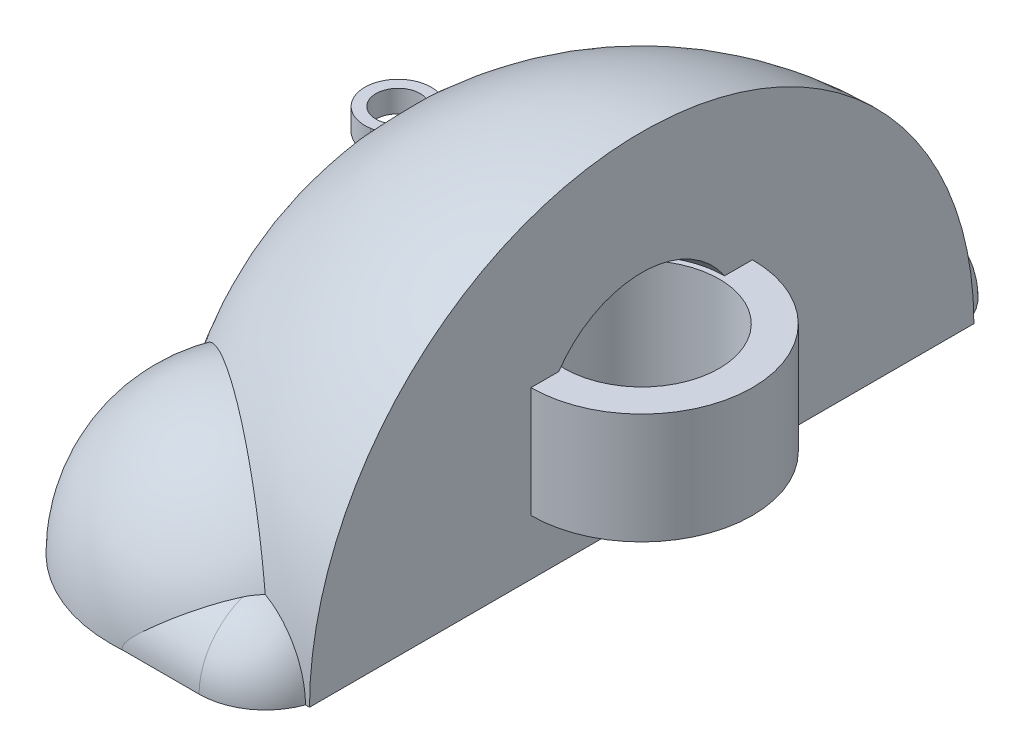
from build123d import *

# Parameters (mm, degrees)
REVOLUCI_N1_ANGLE            = 90
REVOLUCI_N16_ANGLE           = 180
REVOLUCI_N20_ANGLE           = 180
REVOLUCI_N23_ANGLE           = 180
REVOLUCI_N24_ANGLE           = 180
SALIENTE_EXTRUIR1_DEPTH      = 2.5
SALIENTE_EXTRUIR1_DEPTH_BACK = 2.5
CROQUIS29_R                  = 5
CROQUIS29_R_2                = 3.5
SALIENTE_EXTRUIR2_DEPTH      = 0.5
SALIENTE_EXTRUIR2_DEPTH_BACK = 0.5
CROQUIS31_R                  = 1.5
CROQUIS31_R_2                = 1


with BuildPart() as part:
    # Croquis2 → Revolución1 (revolve)
    with BuildSketch(Plane(origin=(0, 0, 0), x_dir=(1, 0, 0), z_dir=(0, 1, 0))):
        with BuildLine():
            Line((0, 15), (0, -15))
            ThreePointArc((0, -15), (-15, 0), (0, 15))
        make_face()
    revolve(axis=Axis((0, 0, -15), (0, 0, -1)), revolution_arc=REVOLUCI_N1_ANGLE)

    # Croquis21 → Revolución16 (revolve)
    with BuildSketch(Plane(origin=(0, 0, 0), x_dir=(1, 0, 0), z_dir=(0, 1, 0))):
        with BuildLine():
            Line((-7, -3), (-7, -17))
            ThreePointArc((-7, -17), (-14, -10), (-7, -3))
        make_face()
    revolve(axis=Axis((-7, 0, 3), (0, 0, -1)), revolution_arc=REVOLUCI_N16_ANGLE)

    # Croquis23 → Revolución20 (revolve)
    with BuildSketch(Plane(origin=(0, 0, 0), x_dir=(1, 0, 0), z_dir=(0, 1, 0))):
        with BuildLine():
            Line((-7, 17), (-7, 3))
            ThreePointArc((-7, 3), (-14, 10), (-7, 17))
        make_face()
    revolve(axis=Axis((-7, 0, -17), (0, 0, -1)), revolution_arc=REVOLUCI_N20_ANGLE)

    # Croquis22 → Revolución23 (revolve)
    with BuildSketch(Plane(origin=(0, 0, 0), x_dir=(1, 0, 0), z_dir=(0, 1, 0))):
        with BuildLine():
            Line((-7.013563461, -16.980899561), (-3.006885101, -16.980899561))
            ThreePointArc((-3.006885101, -16.980899561), (-0.885564757, -16.102219905), (-0.006885101, -13.980899561))
            Line((-0.006885101, -13.980899561), (-8.497150425, -13.980899561))
            Line((-8.497150425, -13.980899561), (-8.472857164, -15.133823361))
            ThreePointArc((-8.472857164, -15.133823361), (-8.190554179, -16.410788184), (-7.013563461, -16.980899561))
        make_face()
    revolve(axis=Axis((-8.497150425, 0, 13.980899561), (-1, 0, 0)), revolution_arc=REVOLUCI_N23_ANGLE)

    # Croquis25 → Revolución24 (revolve)
    with BuildSketch(Plane(origin=(0, 0, 0), x_dir=(1, 0, 0), z_dir=(0, 1, 0))):
        with BuildLine():
            Line((-7.025066442, 10.996556664), (-3.048834395, 10.996556664))
            ThreePointArc((-3.048834395, 10.996556664), (-0.927514051, 11.875236321), (-0.048834395, 13.996556664))
            Line((-0.048834395, 13.996556664), (-8.550103378, 13.996556664))
            Line((-8.550103378, 13.996556664), (-8.514806458, 12.321414768))
            ThreePointArc((-8.514806458, 12.321414768), (-8.021883164, 11.375683602), (-7.025066442, 10.996556664))
        make_face()
    revolve(axis=Axis((-8.550103378, 0, -13.996556664), (-1, 0, 0)), revolution_arc=REVOLUCI_N24_ANGLE)

    # Croquis26 → Cortar-Revolución1 (revolve, cut)
    with BuildSketch(Plane(origin=(0, 0, 0), x_dir=(0, 0, -1), z_dir=(1, 0, 0))):
        with BuildLine():
            Line((-4.5, 5), (4.5, 5))
            ThreePointArc((4.5, 5), (0, 0.5), (-4.5, 5))
        make_face()
    revolve(axis=Axis((0, 5, 4.5), (0, 0, -1)), mode=Mode.SUBTRACT)

    # Croquis29 → Saliente-Extruir1 (add, two sides: drawn at the far end of the back side and taken through both)
    with BuildSketch(Plane(origin=(0, 5, 0), x_dir=(1, 0, 0), z_dir=(0, 1, 0)).offset(-SALIENTE_EXTRUIR1_DEPTH_BACK)):
        Circle(CROQUIS29_R)
        with Locations(Location((0, 0, 0), (0, 0, 270))):
            Circle(CROQUIS29_R_2, mode=Mode.SUBTRACT)
    extrude(amount=SALIENTE_EXTRUIR1_DEPTH + SALIENTE_EXTRUIR1_DEPTH_BACK)

    # Croquis32 → Cortar-Revolución2 (revolve, cut)
    with BuildSketch(Plane(origin=(-11, 0, 0), x_dir=(0, 0, -1), z_dir=(1, 0, 0))):
        with BuildLine():
            Line((1.544761664, 9.980271611), (-1.544761664, 9.980271611))
            ThreePointArc((-1.544761664, 9.980271611), (0, 11.525033275), (1.544761664, 9.980271611))
        make_face()
    revolve(axis=Axis((-11, 9.980271611, -1.544761664), (0, 0, 1)), mode=Mode.SUBTRACT)

    # Croquis31 → Saliente-Extruir2 (add, two sides: drawn at the far end of the back side and taken through both)
    with BuildSketch(Plane(origin=(0, 10, 0), x_dir=(1, 0, 0), z_dir=(0, 1, 0)).offset(-SALIENTE_EXTRUIR2_DEPTH_BACK)):
        with Locations(Location((-11, 0, 0), (0, 0, 279.349397008))):
            Circle(CROQUIS31_R)
        with Locations(Location((-11, 0, 0), (0, 0, 270))):
            Circle(CROQUIS31_R_2, mode=Mode.SUBTRACT)
    extrude(amount=SALIENTE_EXTRUIR2_DEPTH + SALIENTE_EXTRUIR2_DEPTH_BACK)


solid = part.part
